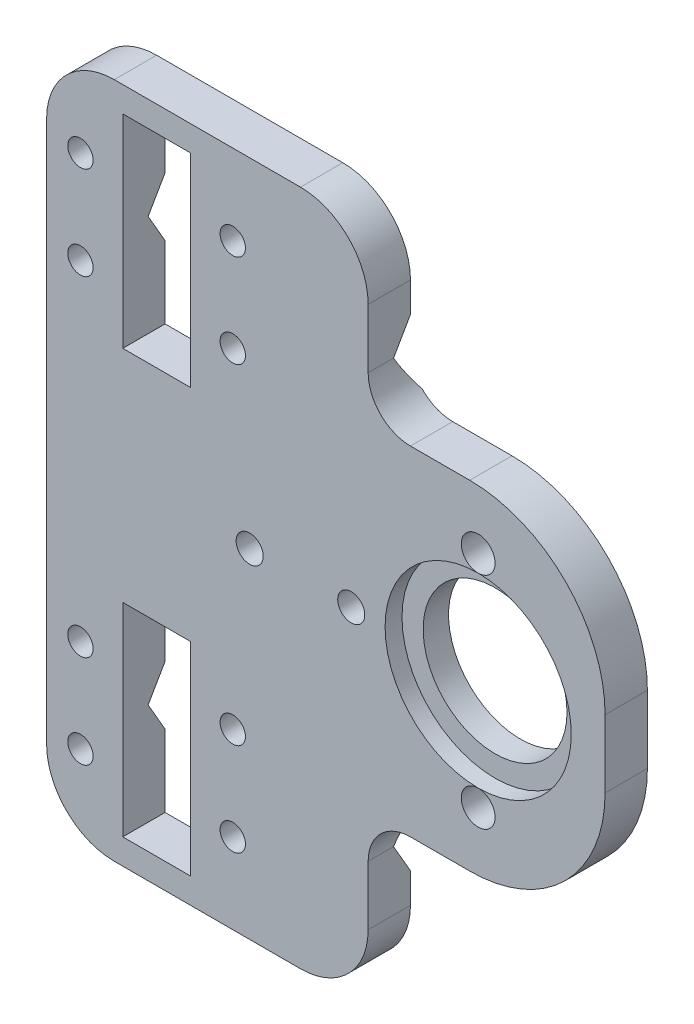
from build123d import *

# Parameters (mm, degrees)
ESBO_O1_R                = 1.5
ESBO_O1_W                = 8
ESBO_O1_H                = 24
RESSALTO_EXTRUS_O1_DEPTH = 5
CORTE_EXTRUS_O1_DEPTH    = 56.398555938
ESBO_O6_R                = 8.5
CORTE_EXTRUS_O3_DEPTH    = 62.919302322
ESBO_O6_3_R              = 11
ESBO_O6_3_R_2            = 8.5
CORTE_EXTRUS_O4_DEPTH    = 2
FURO_ROSCADO_DE_M41_D    = 4
FILETE1_R                = 16
FILETE2_R                = 5
FILETE3_R                = 8
ESBO_O9_R                = 1.6
CORTE_EXTRUS_O9_DEPTH    = 62.919302322


with BuildPart() as part:
    # Esboço1 → Ressalto-extrusão1 (new body)
    with BuildSketch(Plane.XY):
        Polygon((19, 40), (-19, 40), (-19, -40), (19, -40), (19, -20), (47, -20), (47, 20), (19, 20), align=None)
        with Locations((-15, -30.5)):
            Circle(ESBO_O1_R, mode=Mode.SUBTRACT)
        with Locations((-6, -25)):
            Rectangle(ESBO_O1_W, ESBO_O1_H, mode=Mode.SUBTRACT)
        with Locations((3, -30.5)):
            Circle(ESBO_O1_R, mode=Mode.SUBTRACT)
        with Locations((-15, -19.5)):
            Circle(ESBO_O1_R, mode=Mode.SUBTRACT)
        with Locations((3, -19.5)):
            Circle(ESBO_O1_R, mode=Mode.SUBTRACT)
        with Locations((-15, 19.5)):
            Circle(ESBO_O1_R, mode=Mode.SUBTRACT)
        with Locations((3, 19.5)):
            Circle(ESBO_O1_R, mode=Mode.SUBTRACT)
        with Locations((-6, 25)):
            Rectangle(ESBO_O1_W, ESBO_O1_H, mode=Mode.SUBTRACT)
        with Locations((-15, 30.5)):
            Circle(ESBO_O1_R, mode=Mode.SUBTRACT)
        with Locations((3, 30.5)):
            Circle(ESBO_O1_R, mode=Mode.SUBTRACT)
    extrude(amount=RESSALTO_EXTRUS_O1_DEPTH)

    # Esboço2 → Corte-extrusão1 (cut, through all)
    with BuildSketch(Plane(origin=(19, 0, 0), x_dir=(0, 0, -1), z_dir=(1, 0, 0))):
        Polygon((-2, 25), (0, 28.464101615), (0, 21.535898385), align=None)
        Polygon((-2, -25), (0, -21.535898385), (0, -28.464101615), align=None)
    extrude(amount=-CORTE_EXTRUS_O1_DEPTH, mode=Mode.SUBTRACT)

    # Esboço6 → Corte-extrusão3 (cut, through all)
    with BuildSketch(Plane.XY.offset(5)):
        with Locations((32, 0)):
            Circle(ESBO_O6_R)
    extrude(amount=-CORTE_EXTRUS_O3_DEPTH, mode=Mode.SUBTRACT)

    # Esboço6<3> → Corte-extrusão4 (cut)
    with BuildSketch(Plane.XY.offset(5)):
        with Locations((32, 0)):
            Circle(ESBO_O6_3_R)
        with Locations((32, 0)):
            Circle(ESBO_O6_3_R_2, mode=Mode.SUBTRACT)
    extrude(amount=-CORTE_EXTRUS_O4_DEPTH, mode=Mode.SUBTRACT)

    # Furo roscado de M41 (through all)
    with Locations(Plane(origin=(-8.290173831, 15.833247685, 5), x_dir=(1, 0, 0), z_dir=(0, 0, 1))):
        with Locations((40.290173831, -2.832747685), (40.290173831, -28.833747685)):
            Hole(FURO_ROSCADO_DE_M41_D / 2)

    # Filete1
    filete1_edges = [part.edges().sort_by_distance(p)[0] for p in [
        (47, -20, 2.5),
        (47, 20, 2.5),
    ]]
    fillet(filete1_edges, radius=FILETE1_R)

    # Filete2
    filete2_edges = [part.edges().sort_by_distance(p)[0] for p in [
        (19, -20, 2.5),
        (19, 20, 2.5),
    ]]
    fillet(filete2_edges, radius=FILETE2_R)

    # Filete3
    filete3_edges = [part.edges().sort_by_distance(p)[0] for p in [
        (-19, -40, 2.5),
        (19, -40, 2.5),
        (19, 40, 2.5),
        (-19, 40, 2.5),
    ]]
    fillet(filete3_edges, radius=FILETE3_R)

    # Esboço9 → Corte-extrusão9 (cut, through all)
    with BuildSketch(Plane.XY):
        with Locations((5, 0)):
            Circle(ESBO_O9_R)
        with Locations((17, 0)):
            Circle(ESBO_O9_R)
    extrude(amount=CORTE_EXTRUS_O9_DEPTH, mode=Mode.SUBTRACT)


solid = part.part
